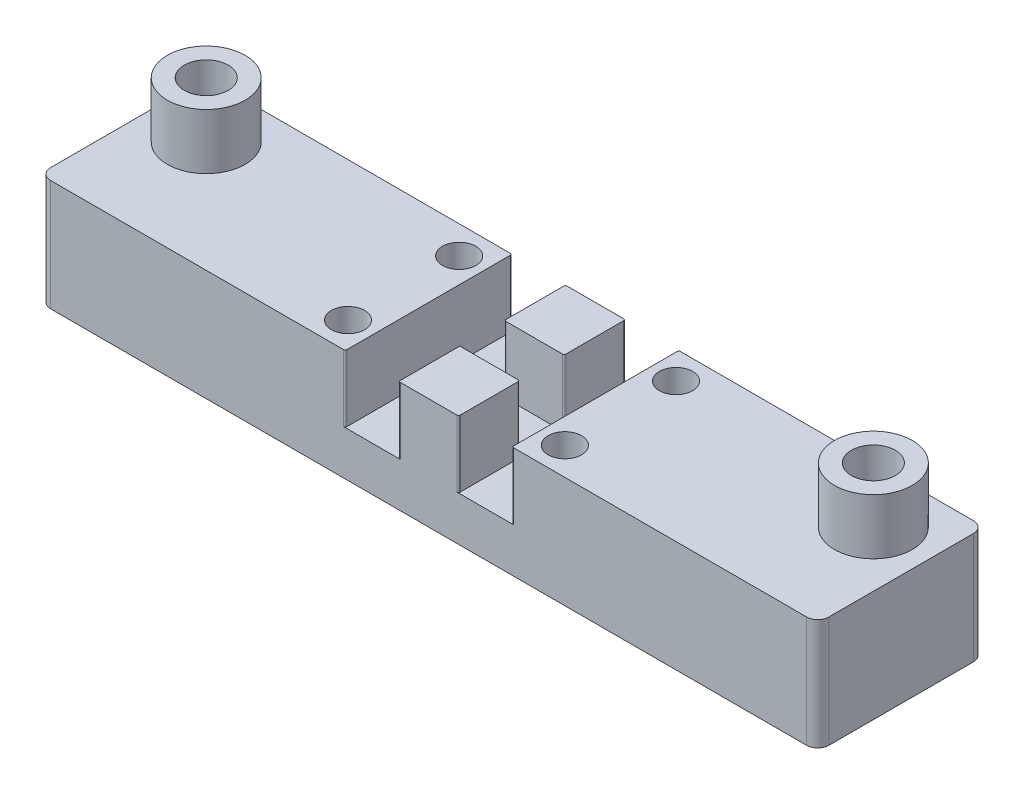
from build123d import *

# Parameters (mm, degrees)
SKETCH1_W           = 70
SKETCH1_H           = 15
SKETCH1_R           = 1.75
SKETCH1_R_2         = 1.5
BOSS_EXTRUDE1_DEPTH = 10
SKETCH2_W           = 15
SKETCH2_H           = 15
CUT_EXTRUDE1_DEPTH  = 6
SKETCH3_W           = 5.388877434
SKETCH3_H           = 5.5
BOSS_EXTRUDE2_DEPTH = 6
FILLET1_R           = 1
FILLET2_R           = 0.15
SKETCH4_R           = 3.5
SKETCH4_R_2         = 1.75
BOSS_EXTRUDE3_DEPTH = 5
SKETCH5_R           = 1.85
CUT_EXTRUDE2_DEPTH  = 74.143694192
SKETCH6_R           = 1.975
CUT_EXTRUDE3_DEPTH  = 4


with BuildPart() as part:
    # Sketch1 → Boss-Extrude1 (new body)
    with BuildSketch(Plane(origin=(0, 0, 0), x_dir=(1, 0, 0), z_dir=(0, 1, 0))):
        with Locations((35, 7.5)):
            Rectangle(SKETCH1_W, SKETCH1_H)
        with Locations(Location((5, 10, 0), (0, 0, 270))):
            Circle(SKETCH1_R, mode=Mode.SUBTRACT)
        with Locations(Location((65, 10, 0), (0, 0, 270))):
            Circle(SKETCH1_R, mode=Mode.SUBTRACT)
        with Locations(Location((25.25, 12.5, 0), (0, 0, 270))):
            Circle(SKETCH1_R_2, mode=Mode.SUBTRACT)
        with Locations(Location((44.75, 12.5, 0), (0, 0, 90))):
            Circle(SKETCH1_R_2, mode=Mode.SUBTRACT)
        with Locations(Location((44.75, 2.5, 0), (0, 0, 270))):
            Circle(SKETCH1_R_2, mode=Mode.SUBTRACT)
        with Locations(Location((25.25, 2.5, 0), (0, 0, 90))):
            Circle(SKETCH1_R_2, mode=Mode.SUBTRACT)
    extrude(amount=BOSS_EXTRUDE1_DEPTH)

    # Sketch2 → Cut-Extrude1 (cut)
    with BuildSketch(Plane(origin=(0, 10, 0), x_dir=(1, 0, 0), z_dir=(0, 1, 0))):
        with Locations((35, 7.5)):
            Rectangle(SKETCH2_W, SKETCH2_H)
    extrude(amount=-CUT_EXTRUDE1_DEPTH, mode=Mode.SUBTRACT)

    # Sketch3 → Boss-Extrude2 (add)
    with BuildSketch(Plane(origin=(0, 4, 0), x_dir=(1, 0, 0), z_dir=(0, 1, 0))):
        with Locations((35, 12.25)):
            Rectangle(SKETCH3_W, SKETCH3_H)
        with Locations((35, 2.75)):
            Rectangle(SKETCH3_W, SKETCH3_H)
    extrude(amount=BOSS_EXTRUDE2_DEPTH)

    # Fillet1
    fillet1_edges = [part.edges().sort_by_distance(p)[0] for p in [
        (0, 5, -15),
        (70, 5, -15),
        (70, 5, 0),
        (0, 5, 0),
    ]]
    fillet(fillet1_edges, radius=FILLET1_R)

    # Fillet2
    fillet2_edges = [part.edges().sort_by_distance(p)[0] for p in [
        (27.5, 7, 0),
        (27.5, 7, -15),
        (42.5, 7, -15),
        (42.5, 7, 0),
        (32.305561283, 7, -15),
        (32.305561283, 7, -9.5),
        (37.694438717, 7, -9.5),
        (37.694438717, 7, -15),
        (32.305561283, 7, 0),
        (37.694438717, 7, 0),
        (37.694438717, 7, -5.5),
    ]]
    fillet(fillet2_edges, radius=FILLET2_R)

    # Sketch4 → Boss-Extrude3 (add)
    # profile 1 of 2: a face of its own
    with BuildSketch(Plane(origin=(0, 10, 0), x_dir=(1, 0, 0), z_dir=(0, 1, 0))):
        with Locations(Location((5, 10, 0), (0, 0, 90))):
            Circle(SKETCH4_R)
        with Locations(Location((5, 10, 0), (0, 0, 90))):
            Circle(SKETCH4_R_2, mode=Mode.SUBTRACT)
    # profile 2 of 2: a face of its own
    with BuildSketch(Plane(origin=(0, 10, 0), x_dir=(1, 0, 0), z_dir=(0, 1, 0))):
        with Locations(Location((65, 10, 0), (0, 0, 90))):
            Circle(SKETCH4_R)
        with Locations(Location((65, 10, 0), (0, 0, 90))):
            Circle(SKETCH4_R_2, mode=Mode.SUBTRACT)
    extrude(amount=BOSS_EXTRUDE3_DEPTH)

    # Sketch5 → Cut-Extrude2 (cut, through all)
    with BuildSketch(Plane(origin=(0, 15, 0), x_dir=(1, 0, 0), z_dir=(0, 1, 0))):
        with Locations(Location((5, 10, 0), (0, 0, 270))):
            Circle(SKETCH5_R)
        with Locations(Location((65, 10, 0), (0, 0, 270))):
            Circle(SKETCH5_R)
    extrude(amount=-CUT_EXTRUDE2_DEPTH, mode=Mode.SUBTRACT)

    # Sketch6 → Cut-Extrude3 (cut)
    with BuildSketch(Plane(origin=(0, 15, 0), x_dir=(1, 0, 0), z_dir=(0, 1, 0))):
        with Locations(Location((5, 10, 0), (0, 0, 270))):
            Circle(SKETCH6_R)
        with Locations(Location((65, 10, 0), (0, 0, 270))):
            Circle(SKETCH6_R)
    extrude(amount=-CUT_EXTRUDE3_DEPTH, mode=Mode.SUBTRACT)


solid = part.part
